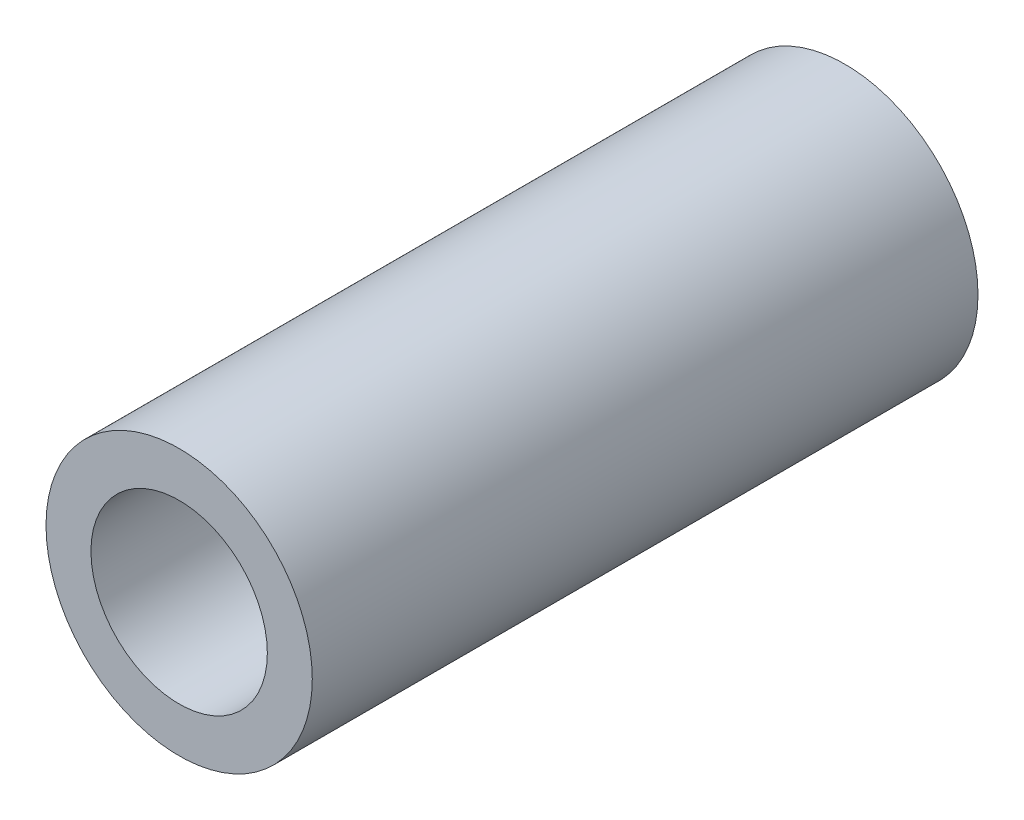
from build123d import *

# Parameters (mm, degrees)
SKETCH1_R      = 4
SKETCH1_R_2    = 2.65
EXTRUDE1_DEPTH = 10


with BuildPart() as part:
    # Sketch1 → Extrude1 (new, symmetric)
    with BuildSketch(Plane.XY):
        Circle(SKETCH1_R)
        Circle(SKETCH1_R_2, mode=Mode.SUBTRACT)
    extrude(amount=EXTRUDE1_DEPTH, both=True)


solid = part.part
